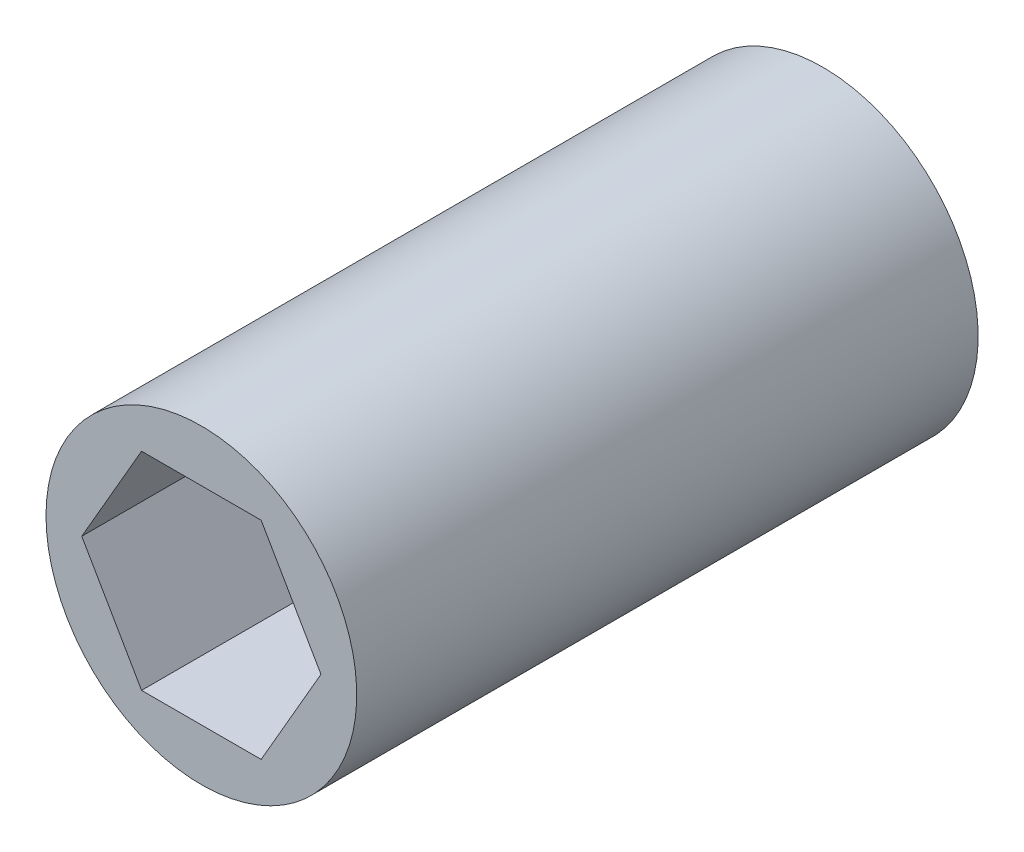
from build123d import *

# Parameters (mm, degrees)
SKETCH1_R           = 9.525
BOSS_EXTRUDE1_DEPTH = 38.1


with BuildPart() as part:
    # Sketch1 → Boss-Extrude1 (new body)
    with BuildSketch(Plane.XY):
        with Locations(Location((0, 0, 0), (0, 0, 180))):
            Circle(SKETCH1_R)
        Polygon((-7.332348419, 0), (-3.666174209, -6.35), (3.666174209, -6.35), (7.332348419, 0), (3.666174209, 6.35), (-3.666174209, 6.35), align=None, mode=Mode.SUBTRACT)
    extrude(amount=BOSS_EXTRUDE1_DEPTH)


solid = part.part
